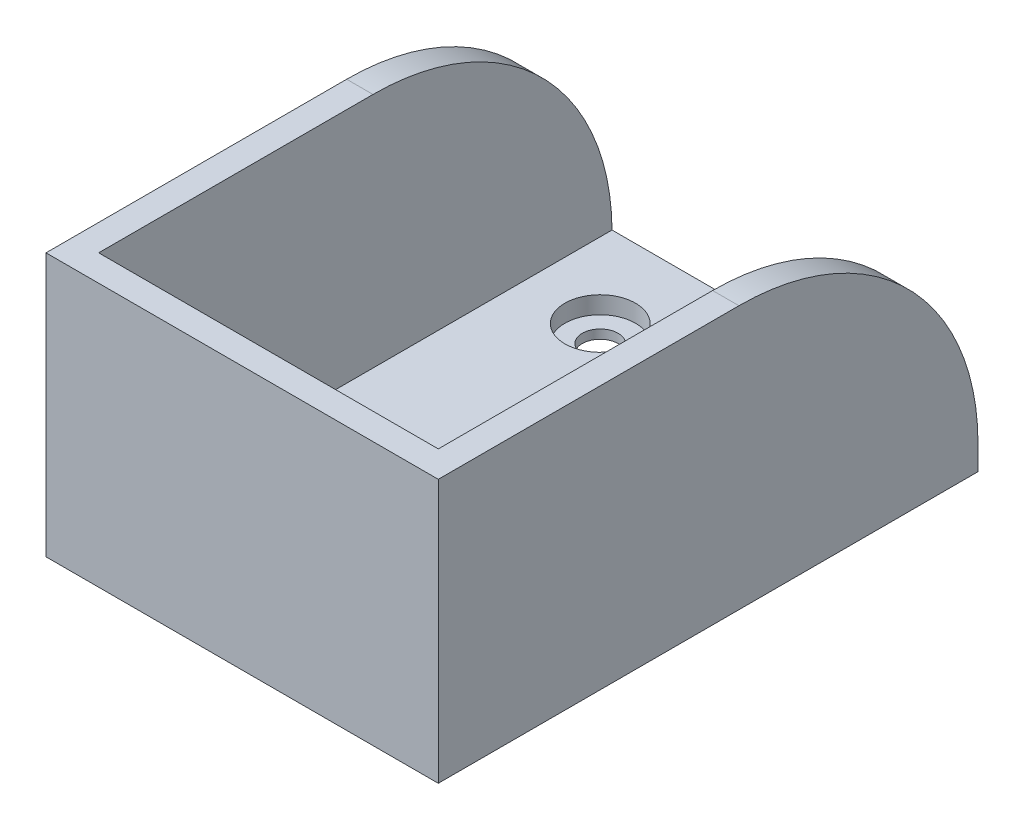
from build123d import *

# Parameters (mm, degrees)
SKETCH12_W                      = 32.25
SKETCH12_H                      = 46.25
BOSS_EXTRUDE2_DEPTH             = 2.5
CBORE_FOR_M3_SBHCS1_D           = 3.4
CBORE_FOR_M3_SBHCS1_CBORE_D     = 6.7
CBORE_FOR_M3_SBHCS1_CBORE_DEPTH = 1.65
F_6_0MM_DOWEL_HOLE1_D           = 6.25
SKETCH20_W                      = 46.25
SKETCH20_H                      = 25
BOSS_EXTRUDE3_DEPTH             = 2.5
FILLET1_R                       = 22.7
BOSS_EXTRUDE4_DEPTH             = 2.5
SKETCH23_W                      = 37.25
SKETCH23_H                      = 25
BOSS_EXTRUDE5_DEPTH             = 2.5


with BuildPart() as part:
    # Sketch12 → Boss-Extrude2 (new body)
    with BuildSketch(Plane(origin=(0, 0, 0), x_dir=(1, 0, 0), z_dir=(0, 1, 0))):
        Rectangle(SKETCH12_W, SKETCH12_H)
    extrude(amount=BOSS_EXTRUDE2_DEPTH)

    # CBORE for M3 SBHCS1 (through all)
    with Locations(Plane(origin=(0, 2.5, 0), x_dir=(1, 0, 0), z_dir=(0, 1, 0))):
        with Locations((-9, 14.875), (9, 14.875), (9, -18.125), (-9, -18.125)):
            CounterBoreHole(CBORE_FOR_M3_SBHCS1_D / 2, CBORE_FOR_M3_SBHCS1_CBORE_D / 2, CBORE_FOR_M3_SBHCS1_CBORE_DEPTH)

    # Ø6.0mm Dowel Hole1 (through all)
    with Locations(Plane(origin=(0, 2.5, 0), x_dir=(1, 0, 0), z_dir=(0, 1, 0))):
        with Locations((0, -9.125)):
            Hole(F_6_0MM_DOWEL_HOLE1_D / 2)

    # Sketch20 → Boss-Extrude3 (add)
    with BuildSketch(Plane.ZY.offset(16.125)):
        with Locations((0, 12.5)):
            Rectangle(SKETCH20_W, SKETCH20_H)
    boss_extrude3 = extrude(amount=BOSS_EXTRUDE3_DEPTH)

    # Mirror1: Boss-Extrude3 across plane
    add(boss_extrude3.mirror(Plane.ZY))

    # Fillet1
    fillet1_edges = [part.edges().sort_by_distance(p)[0] for p in [
        (-17.375, 25, -23.125),
    ]]
    fillet(fillet1_edges, radius=FILLET1_R)

    # Sketch22 → Boss-Extrude4 (add)
    with BuildSketch(Plane.XY.offset(23.125)):
        Polygon((-18.625, 0), (18.625, 0), (18.625, 25), (16.125, 25), (16.125, 2.5), (-16.125, 2.5), (-16.125, 25), (-18.625, 25), align=None)
    extrude(amount=BOSS_EXTRUDE4_DEPTH)

    # Sketch23 → Boss-Extrude5 (add)
    with BuildSketch(Plane.XY.offset(25.625)):
        with Locations((0, 12.5)):
            Rectangle(SKETCH23_W, SKETCH23_H)
    extrude(amount=BOSS_EXTRUDE5_DEPTH)


solid = part.part
